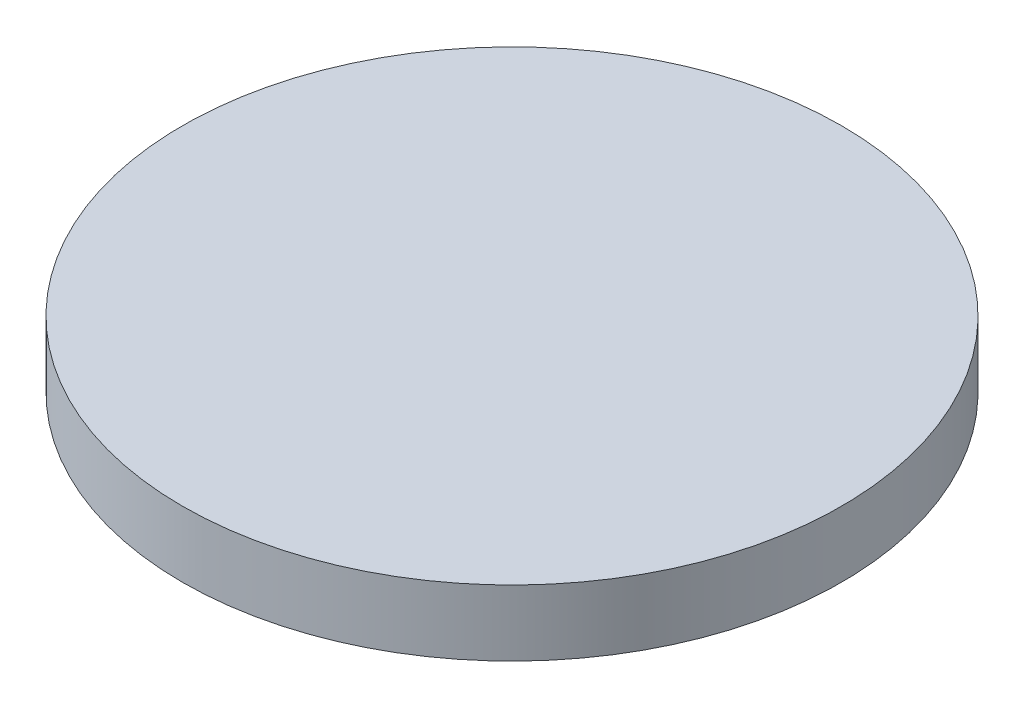
from build123d import *

# Parameters (mm, degrees)
SKETCH1_R           = 40
BOSS_EXTRUDE1_DEPTH = 8


with BuildPart() as part:
    # Sketch1 → Boss-Extrude1 (new body)
    with BuildSketch(Plane(origin=(0, 0, 0), x_dir=(1, 0, 0), z_dir=(0, 1, 0))):
        with Locations(Location((0, 0, 0), (0, 0, 270))):
            Circle(SKETCH1_R)
    extrude(amount=BOSS_EXTRUDE1_DEPTH)


solid = part.part
